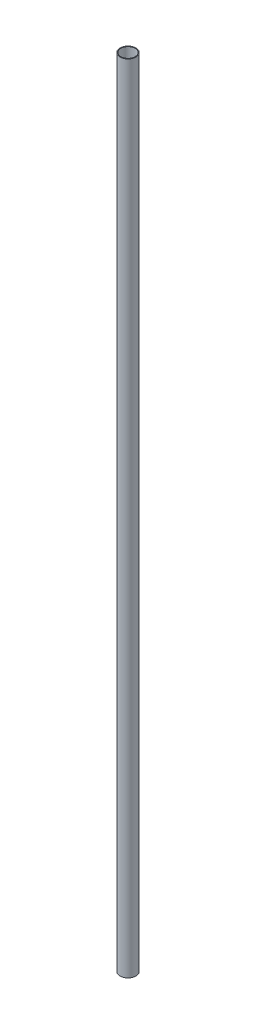
from build123d import *

# Parameters (mm, degrees)
SKETCH_1_R      = 10
SKETCH_1_R_2    = 9
EXTRUDE_1_DEPTH = 1000


with BuildPart() as part:
    # 草图1 → 凸台-拉伸1 (new body)
    with BuildSketch(Plane(origin=(0, 0, 0), x_dir=(1, 0, 0), z_dir=(0, 1, 0))):
        with Locations(Location((0, 0, 0), (0, 0, 270))):
            Circle(SKETCH_1_R)
        with Locations(Location((0, 0, 0), (0, 0, 270))):
            Circle(SKETCH_1_R_2, mode=Mode.SUBTRACT)
    extrude(amount=EXTRUDE_1_DEPTH)


solid = part.part
